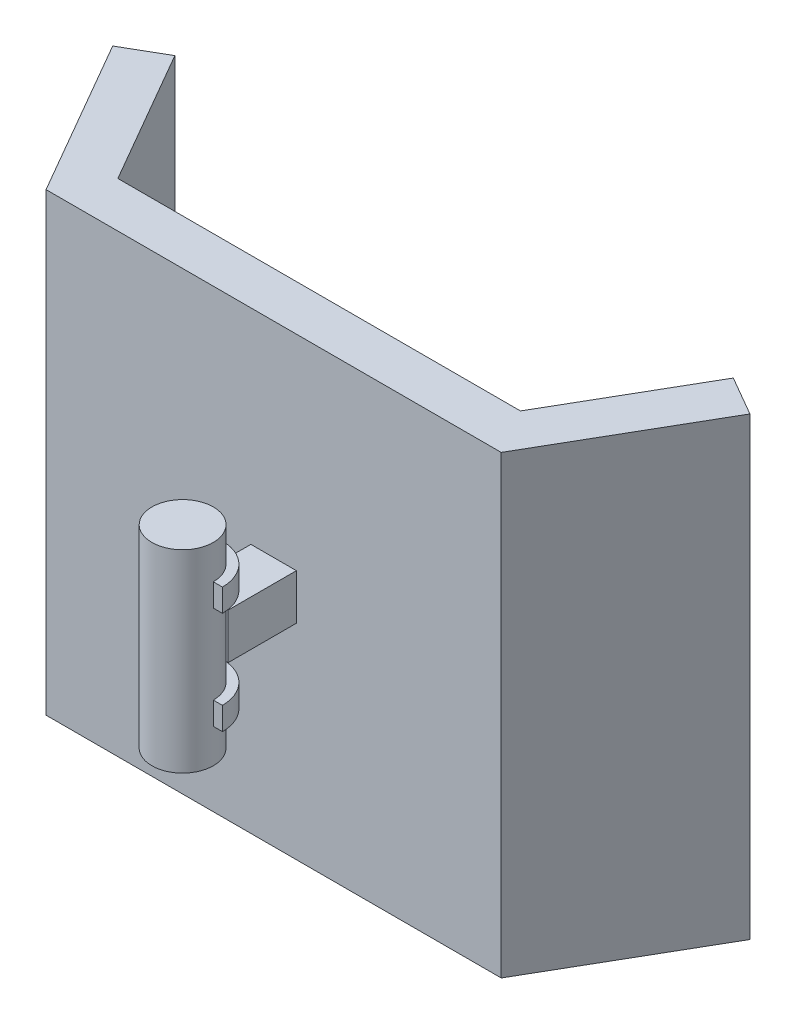
from build123d import *

# Parameters (mm, degrees)
SKETCH_1_W           = 2
SKETCH_1_H           = 2
EXTRUDE_1_DEPTH      = 3
EXTRUDE_2_DEPTH      = 3.25
EXTRUDE_2_DEPTH_BACK = 5.25
SKETCH_2_R           = 1.35
EXTRUDE_5_DEPTH      = 1
EXTRUDE_START        = -1
EXTRUDE_6_DEPTH      = 1
EXTRUDE_7_DEPTH      = 10
EXTRUDE_7_DEPTH_BACK = 10


with BuildPart() as part:
    # 草图1 → 凸台-拉伸1 (new body)
    with BuildSketch(Plane.XY):
        Rectangle(SKETCH_1_W, SKETCH_1_H)
    extrude(amount=EXTRUDE_1_DEPTH)

    # 草图2 → 凸台-拉伸2 (add, two sides: drawn at the far end of the back side and taken through both)
    with BuildSketch(Plane(origin=(0, 1, 0), x_dir=(1, 0, 0), z_dir=(0, 1, 0)).offset(-EXTRUDE_2_DEPTH_BACK)):
        with Locations(Location((0, -4, 0), (0, 0, 270))):
            Circle(SKETCH_2_R)
    extrude(amount=EXTRUDE_2_DEPTH + EXTRUDE_2_DEPTH_BACK)

    # 草图6 → 凸台-拉伸5 (add)
    with BuildSketch(Plane(origin=(0, -2.75, 0), x_dir=(-1, 0, 0), z_dir=(0, -1, 0))):
        with BuildLine():
            Line((-1.75, -4), (1.75, -4))
            ThreePointArc((1.75, -4), (0, -2.25), (-1.75, -4))
        make_face()
    extrude(amount=-EXTRUDE_5_DEPTH)

    # 草图7 → 凸台-拉伸6 (add)
    with BuildSketch(Plane(origin=(0, 2.75, 0), x_dir=(1, 0, 0), z_dir=(0, 1, 0)).offset(EXTRUDE_START)):
        with BuildLine():
            Line((1.75, -4), (-1.75, -4))
            ThreePointArc((-1.75, -4), (0, -2.25), (1.75, -4))
        make_face()
    extrude(amount=EXTRUDE_6_DEPTH)

    # 草图12 → 凸台-拉伸7 (add, two sides: drawn at the far end of the back side and taken through both)
    with BuildSketch(Plane(origin=(0, 0, 0), x_dir=(1, 0, 0), z_dir=(0, 1, 0)).offset(-EXTRUDE_7_DEPTH_BACK)):
        Polygon((10, 0), (-10, 0), (-14, 6.92820323), (-12.267949192, 7.92820323), (-8.845299462, 2), (8.845299462, 2), (12.267949192, 7.92820323), (14, 6.92820323), align=None)
    extrude(amount=EXTRUDE_7_DEPTH + EXTRUDE_7_DEPTH_BACK)


solid = part.part
